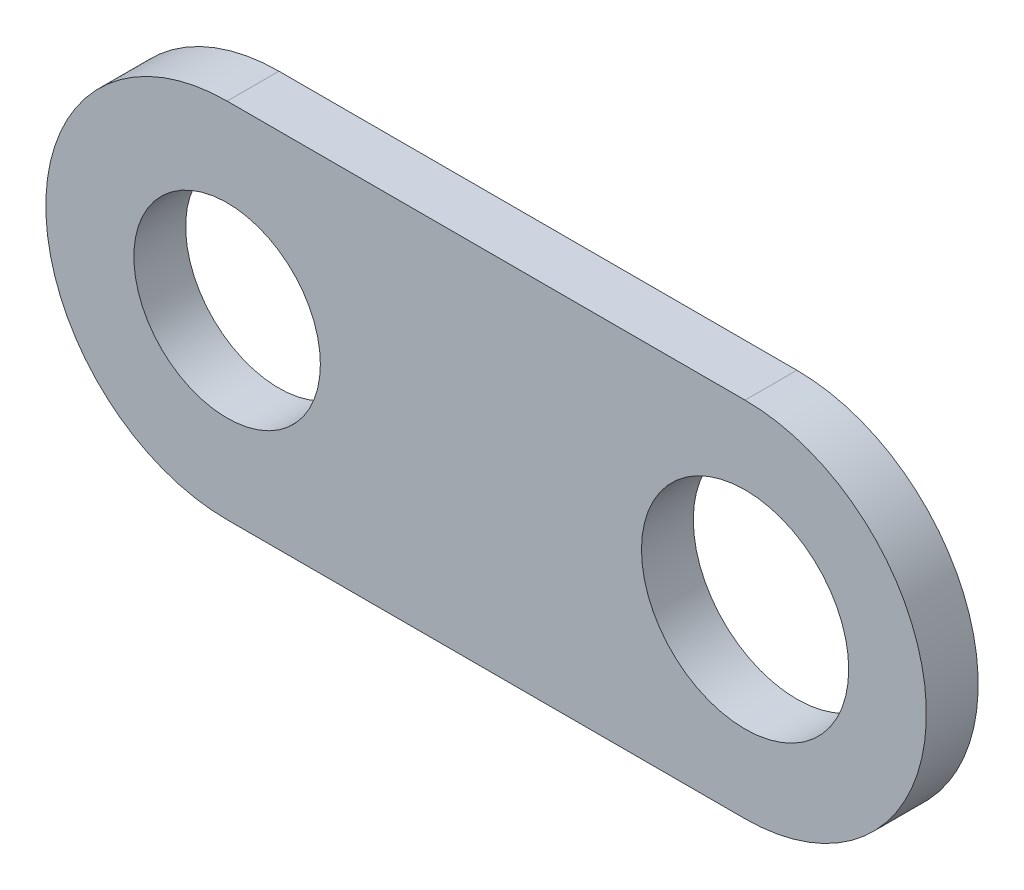
from build123d import *

# Parameters (mm, degrees)
LINK_BODY_DEPTH    = 6.35
SKETCH2_R          = 11.433175
SKETCH2_R_2        = 12.703175
CUT_EXTRUDE1_DEPTH = 89.786534734


with BuildPart() as part:
    # Sketch1 → Link-Body (new body)
    with BuildSketch(Plane.XY):
        with BuildLine():
            Line((0, 22.225), (63.5, 22.225))
            ThreePointArc((63.5, 22.225), (85.725, 0), (63.5, -22.225))
            Line((63.5, -22.225), (0, -22.225))
            ThreePointArc((0, -22.225), (-22.225, 0), (0, 22.225))
        make_face()
    extrude(amount=LINK_BODY_DEPTH)

    # Sketch2 → Cut-Extrude1 (cut, through all)
    with BuildSketch(Plane.XY.offset(6.35)):
        Circle(SKETCH2_R)
        with Locations((63.5, 0)):
            Circle(SKETCH2_R_2)
    extrude(amount=-CUT_EXTRUDE1_DEPTH, mode=Mode.SUBTRACT)


solid = part.part
